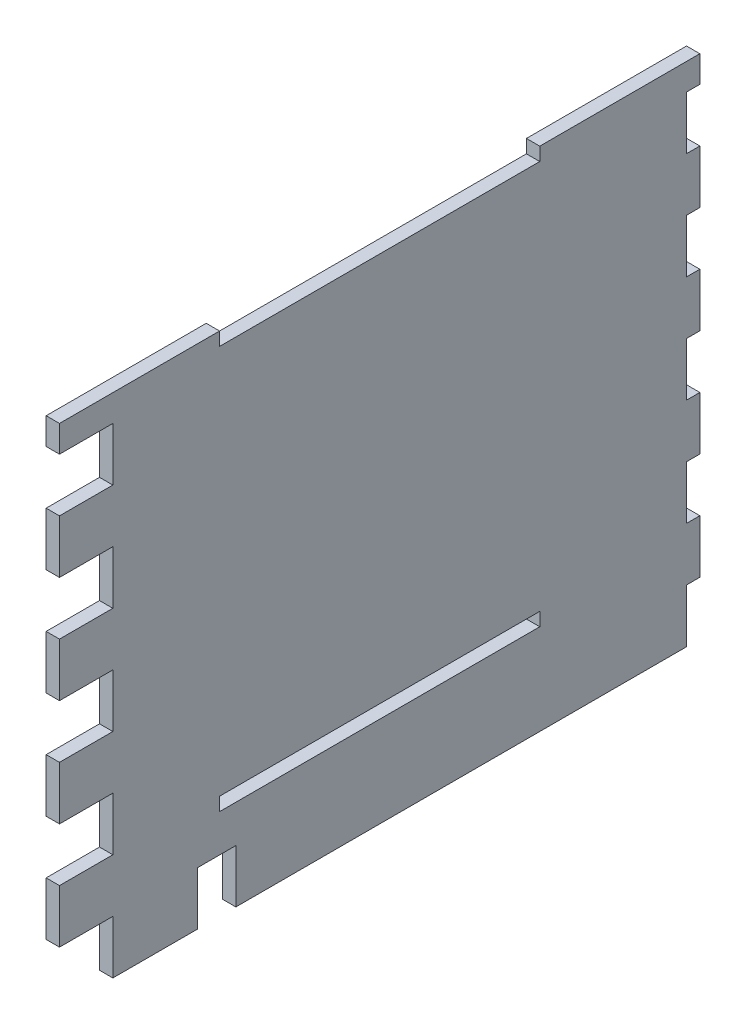
from build123d import *

# Parameters (mm, degrees)
SKETCH1_W                = 304.8
SKETCH1_H                = 241.3
BOSS_EXTRUDE4_DEPTH      = 6.35
SKETCH3_W                = 6.35
SKETCH3_H                = 25.470512821
SKETCH3_H_2              = 25.4
SMALL_TEETH_CUT_DEPTH    = 7.62
BIG_TEETH_CUT_DEPTH      = 360.242006362
BIG_TEETH_CUT_DEPTH_BACK = 360.242006362
BIG_TEETH_W              = 25.4
BIG_TEETH_H              = 25.4
SKETCH4_W                = 152.4
SKETCH4_H                = 6.35
CUT_EXTRUDE1_DEPTH       = 360.242006362
SKETCH5_W                = 18.365609198
SKETCH5_H                = 25.315792254
CUT_EXTRUDE2_DEPTH       = 360.242006362
SKETCH6_W                = 152.4
SKETCH6_H                = 6.35
CUT_EXTRUDE3_DEPTH       = 360.242006362


with BuildPart() as part:
    # Sketch1 → Boss-Extrude4 (new body)
    with BuildSketch(Plane(origin=(0, 0, 0), x_dir=(0, 0, -1), z_dir=(1, 0, 0))):
        with Locations((-173.678767452, 29.972488533)):
            Rectangle(SKETCH1_W, SKETCH1_H)
    extrude(amount=BOSS_EXTRUDE4_DEPTH)

    # Sketch3 → Small_teeth_cut (cut)
    with BuildSketch(Plane.ZY):
        with Locations((24.453767452, -77.942255057)):
            Rectangle(SKETCH3_W, SKETCH3_H)
        with Locations((24.453767452, -27.106998646)):
            Rectangle(SKETCH3_W, SKETCH3_H_2)
        with Locations((24.453767452, 23.693001354)):
            Rectangle(SKETCH3_W, SKETCH3_H_2)
        with Locations((24.453767452, 74.493001354)):
            Rectangle(SKETCH3_W, SKETCH3_H_2)
        with Locations((24.453767452, 125.293001354)):
            Rectangle(SKETCH3_W, SKETCH3_H_2)
    extrude(amount=-SMALL_TEETH_CUT_DEPTH, mode=Mode.SUBTRACT)

    # big teeth → Big_teeth_cut (cut, two sides: drawn at the far end of the back side and taken through both)
    with BuildSketch(Plane(origin=(6.35, 0, 0), x_dir=(0, 0, -1), z_dir=(1, 0, 0)).offset(-BIG_TEETH_CUT_DEPTH_BACK)):
        with Locations((-313.378767452, -77.977511467)):
            Rectangle(BIG_TEETH_W, BIG_TEETH_H)
        with Locations((-313.378767452, -27.177511467)):
            Rectangle(BIG_TEETH_W, BIG_TEETH_H)
        with Locations((-313.378767452, 23.622488533)):
            Rectangle(BIG_TEETH_W, BIG_TEETH_H)
        with Locations((-313.378767452, 74.422488533)):
            Rectangle(BIG_TEETH_W, BIG_TEETH_H)
        with Locations((-313.378767452, 125.222488533)):
            Rectangle(BIG_TEETH_W, BIG_TEETH_H)
    extrude(amount=BIG_TEETH_CUT_DEPTH + BIG_TEETH_CUT_DEPTH_BACK, mode=Mode.SUBTRACT)

    # Sketch4 → Cut-Extrude1 (cut, through all)
    with BuildSketch(Plane(origin=(6.35, 0, 0), x_dir=(0, 0, -1), z_dir=(1, 0, 0))):
        with Locations((-173.678767452, 147.447488533)):
            Rectangle(SKETCH4_W, SKETCH4_H)
    extrude(amount=-CUT_EXTRUDE1_DEPTH, mode=Mode.SUBTRACT)

    # Sketch5 → Cut-Extrude2 (cut, through all)
    with BuildSketch(Plane.ZY):
        with Locations((251.315206335, -78.01961534)):
            Rectangle(SKETCH5_W, SKETCH5_H)
    extrude(amount=-CUT_EXTRUDE2_DEPTH, mode=Mode.SUBTRACT)

    # Sketch6 → Cut-Extrude3 (cut, through all)
    with BuildSketch(Plane.ZY):
        with Locations((173.678767452, -44.322511467)):
            Rectangle(SKETCH6_W, SKETCH6_H)
    extrude(amount=-CUT_EXTRUDE3_DEPTH, mode=Mode.SUBTRACT)


solid = part.part
